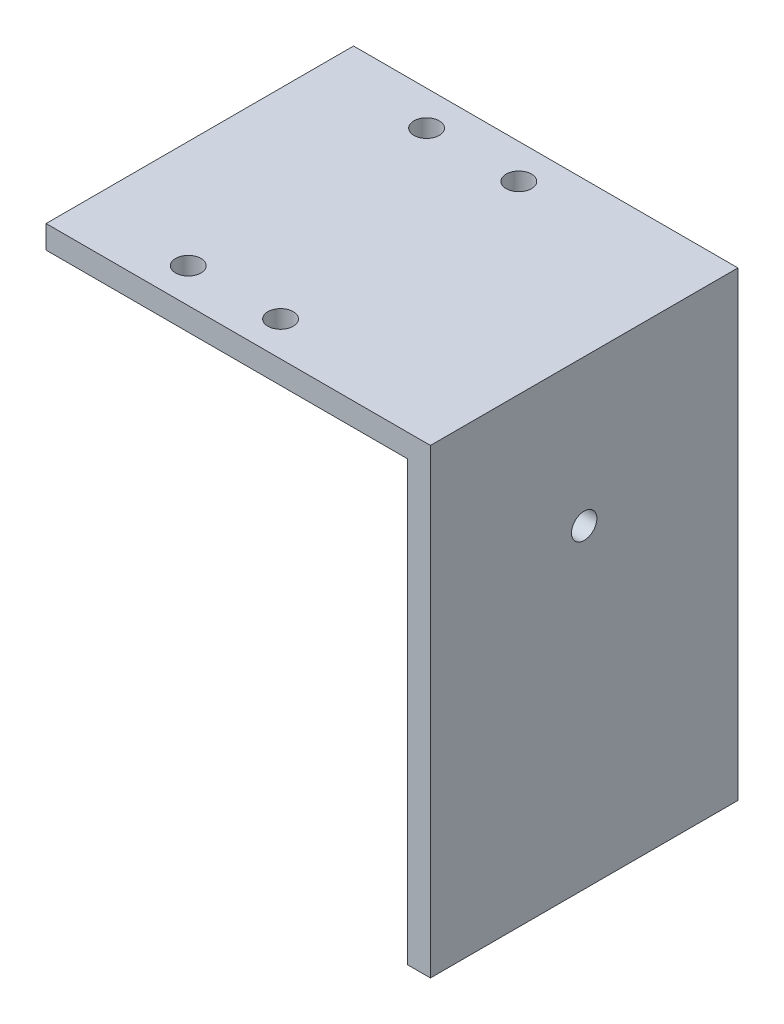
from build123d import *

# Parameters (mm, degrees)
EXTRUDE_1_DEPTH     = 40
SKETCH_2_R          = 1.65
CUT_EXTRUDE_1_DEPTH = 10
SKETCH_3_R          = 1.65
CUT_EXTRUDE_2_DEPTH = 10


with BuildPart() as part:
    # 草图1 → 凸台-拉伸1 (new body)
    with BuildSketch(Plane.XY):
        Polygon((0, 0), (50, 0), (50, -60), (47, -60), (47, -3), (0, -3), align=None)
    extrude(amount=EXTRUDE_1_DEPTH)

    # 草图2 → 切除-拉伸1 (cut)
    with BuildSketch(Plane(origin=(0, 0, 0), x_dir=(1, 0, 0), z_dir=(0, 1, 0))):
        with Locations(Location((14, -4.5, 0), (0, 0, 270))):
            Circle(SKETCH_2_R)
        with Locations(Location((14, -35.5, 0), (0, 0, 270))):
            Circle(SKETCH_2_R)
        with Locations(Location((26, -4.5, 0), (0, 0, 270))):
            Circle(SKETCH_2_R)
        with Locations(Location((26, -35.5, 0), (0, 0, 270))):
            Circle(SKETCH_2_R)
    extrude(amount=-CUT_EXTRUDE_1_DEPTH, mode=Mode.SUBTRACT)

    # 草图3 → 切除-拉伸2 (cut)
    with BuildSketch(Plane(origin=(50, 0, 0), x_dir=(0, 0, -1), z_dir=(1, 0, 0))):
        with Locations((-20, -19.05)):
            Circle(SKETCH_3_R)
    extrude(amount=-CUT_EXTRUDE_2_DEPTH, mode=Mode.SUBTRACT)


solid = part.part
